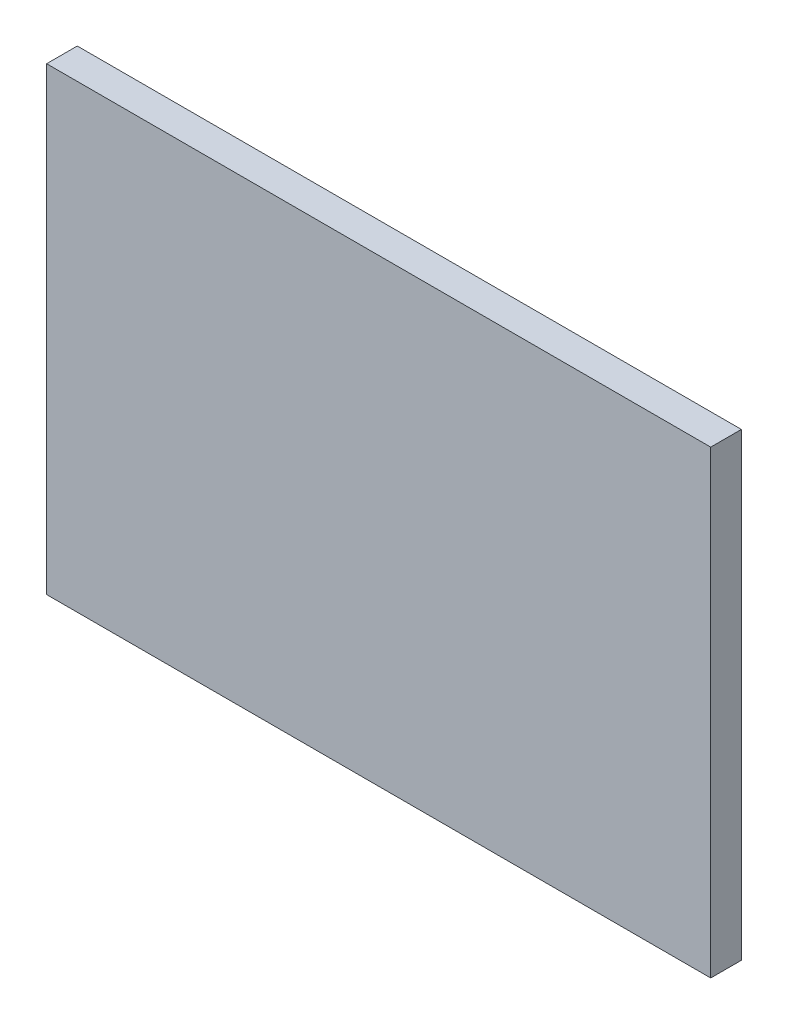
from build123d import *

# Parameters (mm, degrees)
SKETCH_1_W      = 65
SKETCH_1_H      = 3
EXTRUDE_1_DEPTH = 45


with BuildPart() as part:
    # 草图1 → 凸台-拉伸1 (new body)
    with BuildSketch(Plane(origin=(0, 0, 0), x_dir=(1, 0, 0), z_dir=(0, 1, 0))):
        with Locations((-25.741473481, 29.821243096)):
            Rectangle(SKETCH_1_W, SKETCH_1_H)
    extrude(amount=EXTRUDE_1_DEPTH)


solid = part.part
